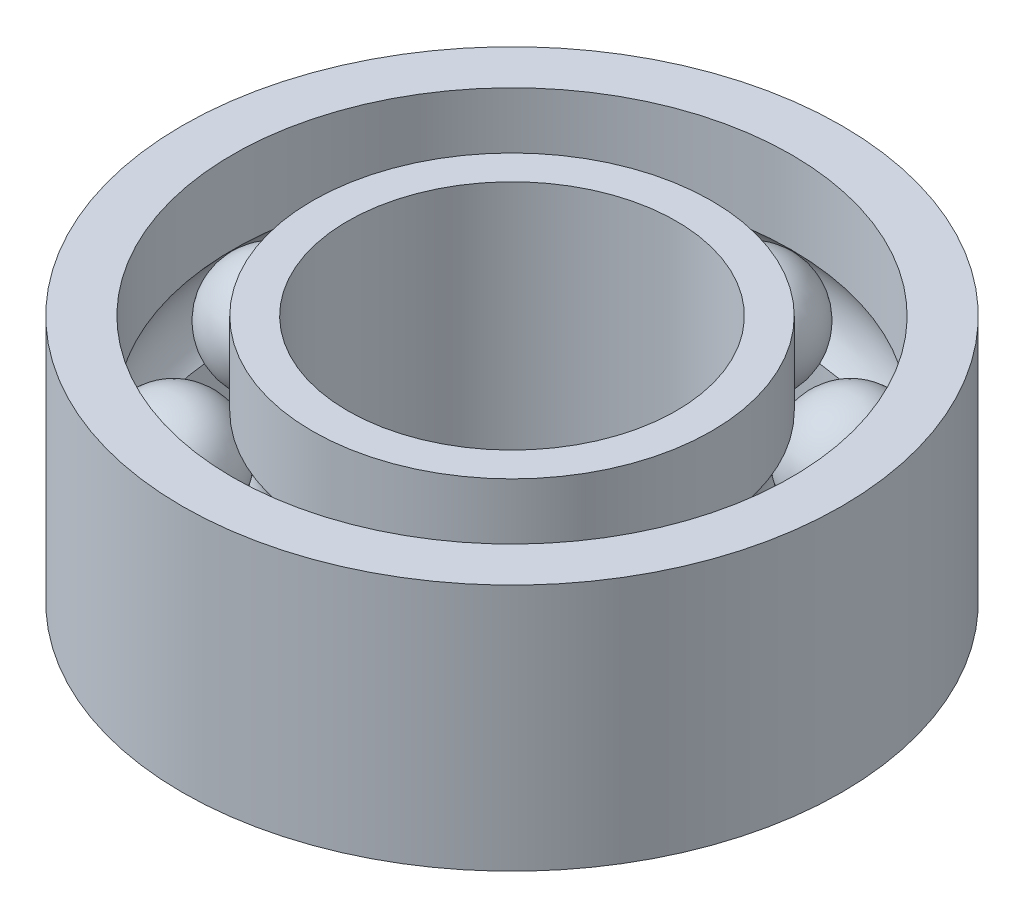
from build123d import *

# Parameters (mm, degrees)
SKETCH_1_R               = 6.36
SKETCH_1_R_2             = 5.39
EXTRUDE_1_DEPTH          = 4.78
SKETCH_2_R               = 3.85
SKETCH_2_R_2             = 3.17
EXTRUDE_2_DEPTH          = 4.78
SKETCH_6_R               = 1.11
PATTERN_CIRCULAR_2_COUNT = 8


with BuildPart() as part:
    # 草图1 → 凸台-拉伸1 (new body)
    with BuildSketch(Plane(origin=(0, 0, 0), x_dir=(1, 0, 0), z_dir=(0, 1, 0))):
        Circle(SKETCH_1_R)
        Circle(SKETCH_1_R_2, mode=Mode.SUBTRACT)
    extrude(amount=EXTRUDE_1_DEPTH)


with BuildPart() as body_2:
    # 草图2 → 凸台-拉伸2 (new body)
    with BuildSketch(Plane(origin=(0, 0, 0), x_dir=(1, 0, 0), z_dir=(0, 1, 0))):
        Circle(SKETCH_2_R)
        Circle(SKETCH_2_R_2, mode=Mode.SUBTRACT)
    extrude(amount=EXTRUDE_2_DEPTH)


with BuildPart() as cut_revolve_5_tool:
    # 草图6 → 切除-旋转5 (revolve)
    with BuildSketch(Plane.XY):
        with Locations((-4.62, 2.39)):
            Circle(SKETCH_6_R)
    revolve(axis=Axis((0, 4.78, 0), (0, -1, 0)))


with BuildPart() as part_1:
    add(part.part)

    # 切除-旋转5: cut by cut_revolve_5_tool
    add(cut_revolve_5_tool.part, mode=Mode.SUBTRACT)


with BuildPart() as body_2_1:
    add(body_2.part)

    # 切除-旋转5: cut by cut_revolve_5_tool
    add(cut_revolve_5_tool.part, mode=Mode.SUBTRACT)


with BuildPart() as body_3:
    # 草图6<3> → 旋转1 (revolve)
    with BuildSketch(Plane.XY):
        with BuildLine():
            Line((-4.62, 1.29), (-4.62, 3.49))
            ThreePointArc((-4.62, 3.49), (-5.72, 2.39), (-4.62, 1.29))
        make_face()
    revolve(axis=Axis((-4.62, 3.49, 0), (0, -1, 0)))


with BuildPart() as pattern_circular_2_1:
    # 阵列(圆周)2: pattern copy
    add(body_3.part.rotate(Axis((0, 4.78, 0), (0, -1, 0)), 1 * 360 / PATTERN_CIRCULAR_2_COUNT))


with BuildPart() as pattern_circular_2_2:
    # 阵列(圆周)2: pattern copy
    add(body_3.part.rotate(Axis((0, 4.78, 0), (0, -1, 0)), 2 * 360 / PATTERN_CIRCULAR_2_COUNT))


with BuildPart() as pattern_circular_2_3:
    # 阵列(圆周)2: pattern copy
    add(body_3.part.rotate(Axis((0, 4.78, 0), (0, -1, 0)), 3 * 360 / PATTERN_CIRCULAR_2_COUNT))


with BuildPart() as pattern_circular_2_4:
    # 阵列(圆周)2: pattern copy
    add(body_3.part.rotate(Axis((0, 4.78, 0), (0, -1, 0)), 4 * 360 / PATTERN_CIRCULAR_2_COUNT))


with BuildPart() as pattern_circular_2_5:
    # 阵列(圆周)2: pattern copy
    add(body_3.part.rotate(Axis((0, 4.78, 0), (0, -1, 0)), 5 * 360 / PATTERN_CIRCULAR_2_COUNT))


with BuildPart() as pattern_circular_2_6:
    # 阵列(圆周)2: pattern copy
    add(body_3.part.rotate(Axis((0, 4.78, 0), (0, -1, 0)), 6 * 360 / PATTERN_CIRCULAR_2_COUNT))


with BuildPart() as pattern_circular_2_7:
    # 阵列(圆周)2: pattern copy
    add(body_3.part.rotate(Axis((0, 4.78, 0), (0, -1, 0)), 7 * 360 / PATTERN_CIRCULAR_2_COUNT))


solid = Compound([part_1.part, body_2_1.part, body_3.part, pattern_circular_2_1.part, pattern_circular_2_2.part, pattern_circular_2_3.part, pattern_circular_2_4.part, pattern_circular_2_5.part, pattern_circular_2_6.part, pattern_circular_2_7.part])
